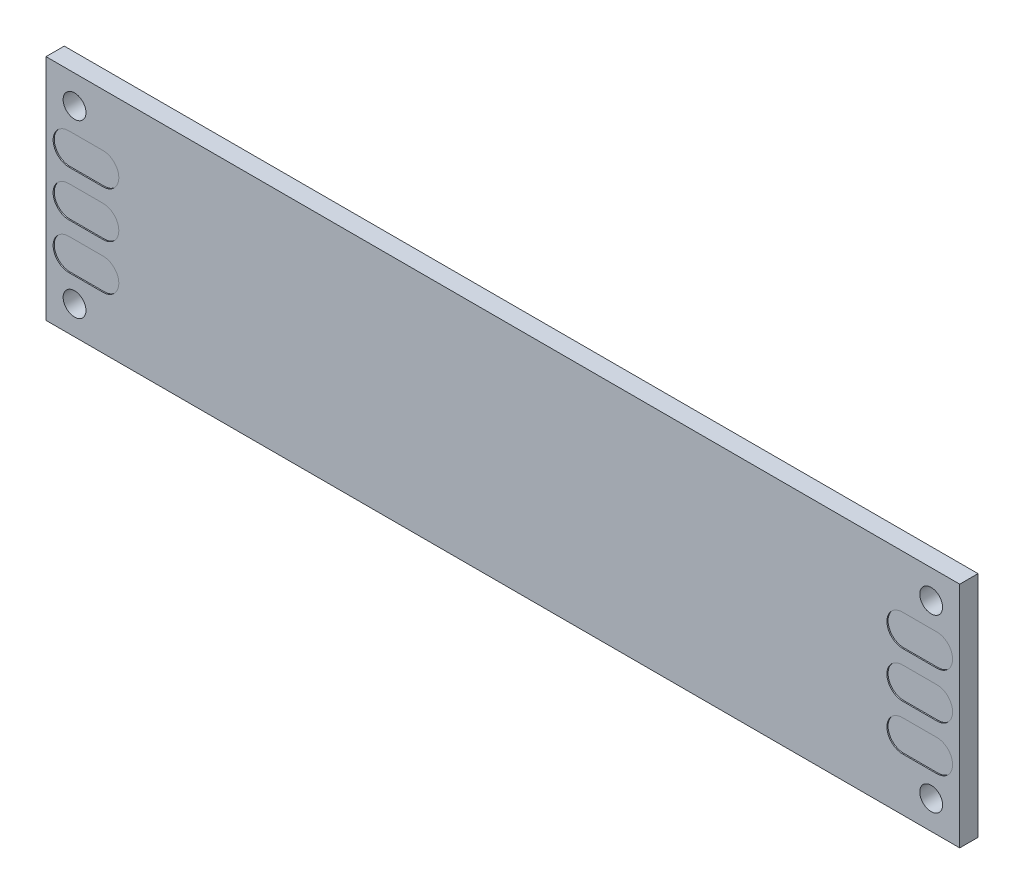
from build123d import *

# Parameters (mm, degrees)
SKETCH_1_W          = 80
SKETCH_1_H          = 20
SKETCH_1_R          = 1
EXTRUDE_1_DEPTH     = 1.6
CUT_EXTRUDE_1_DEPTH = 0.1
CUT_EXTRUDE_START   = -0.1
CUT_EXTRUDE_2_DEPTH = 0.1


with BuildPart() as part:
    # Эскиз1 → Бобышка-Вытянуть1 (new body)
    with BuildSketch(Plane.XY):
        Rectangle(SKETCH_1_W, SKETCH_1_H)
        with Locations((-37.5, 7.5)):
            Circle(SKETCH_1_R, mode=Mode.SUBTRACT)
        with Locations((-37.5, -7.5)):
            Circle(SKETCH_1_R, mode=Mode.SUBTRACT)
        with Locations((37.5, -7.5)):
            Circle(SKETCH_1_R, mode=Mode.SUBTRACT)
        with Locations((37.5, 7.5)):
            Circle(SKETCH_1_R, mode=Mode.SUBTRACT)
    extrude(amount=EXTRUDE_1_DEPTH)

    # Эскиз2 → Вырез-Вытянуть1 (cut)
    with BuildSketch(Plane.XY.offset(1.6)):
        with BuildLine():
            Line((-38, -2.625), (-35, -2.625))
            ThreePointArc((-35, -2.625), (-33.625, -4), (-35, -5.375))
            Line((-35, -5.375), (-38, -5.375))
            ThreePointArc((-38, -5.375), (-39.375, -4), (-38, -2.625))
        make_face()
        with BuildLine():
            Line((-38, 1.375), (-35, 1.375))
            ThreePointArc((-35, 1.375), (-33.625, 0), (-35, -1.375))
            Line((-35, -1.375), (-38, -1.375))
            ThreePointArc((-38, -1.375), (-39.375, 0), (-38, 1.375))
        make_face()
        with BuildLine():
            Line((-38, 5.375), (-35, 5.375))
            ThreePointArc((-35, 5.375), (-33.625, 4), (-35, 2.625))
            Line((-35, 2.625), (-38, 2.625))
            ThreePointArc((-38, 2.625), (-39.375, 4), (-38, 5.375))
        make_face()
        with BuildLine():
            Line((38, -2.625), (35, -2.625))
            ThreePointArc((35, -2.625), (33.625, -4), (35, -5.375))
            Line((35, -5.375), (38, -5.375))
            ThreePointArc((38, -5.375), (39.375, -4), (38, -2.625))
        make_face()
        with BuildLine():
            Line((38, 1.375), (35, 1.375))
            ThreePointArc((35, 1.375), (33.625, 0), (35, -1.375))
            Line((35, -1.375), (38, -1.375))
            ThreePointArc((38, -1.375), (39.375, 0), (38, 1.375))
        make_face()
        with BuildLine():
            Line((38, 5.375), (35, 5.375))
            ThreePointArc((35, 5.375), (33.625, 4), (35, 2.625))
            Line((35, 2.625), (38, 2.625))
            ThreePointArc((38, 2.625), (39.375, 4), (38, 5.375))
        make_face()
    extrude(amount=-CUT_EXTRUDE_1_DEPTH, mode=Mode.SUBTRACT)

    # Эскиз3 → Вырез-Вытянуть2 (cut)
    with BuildSketch(Plane(origin=(0, 0, 0), x_dir=(-1, 0, 0), z_dir=(0, 0, -1)).offset(CUT_EXTRUDE_START)):
        with BuildLine():
            Line((38, 1.375), (35, 1.375))
            ThreePointArc((35, 1.375), (33.625, 0), (35, -1.375))
            Line((35, -1.375), (38, -1.375))
            ThreePointArc((38, -1.375), (39.375, 0), (38, 1.375))
        make_face()
        with BuildLine():
            Line((38, -2.625), (35, -2.625))
            ThreePointArc((35, -2.625), (33.625, -4), (35, -5.375))
            Line((35, -5.375), (38, -5.375))
            ThreePointArc((38, -5.375), (39.375, -4), (38, -2.625))
        make_face()
        with BuildLine():
            Line((38, 5.375), (35, 5.375))
            ThreePointArc((35, 5.375), (33.625, 4), (35, 2.625))
            Line((35, 2.625), (38, 2.625))
            ThreePointArc((38, 2.625), (39.375, 4), (38, 5.375))
        make_face()
        with BuildLine():
            Line((-35, 1.375), (-38, 1.375))
            ThreePointArc((-38, 1.375), (-39.375, 0), (-38, -1.375))
            Line((-38, -1.375), (-35, -1.375))
            ThreePointArc((-35, -1.375), (-33.625, 0), (-35, 1.375))
        make_face()
        with BuildLine():
            Line((-35, -2.625), (-38, -2.625))
            ThreePointArc((-38, -2.625), (-39.375, -4), (-38, -5.375))
            Line((-38, -5.375), (-35, -5.375))
            ThreePointArc((-35, -5.375), (-33.625, -4), (-35, -2.625))
        make_face()
        with BuildLine():
            Line((-35, 5.375), (-38, 5.375))
            ThreePointArc((-38, 5.375), (-39.375, 4), (-38, 2.625))
            Line((-38, 2.625), (-35, 2.625))
            ThreePointArc((-35, 2.625), (-33.625, 4), (-35, 5.375))
        make_face()
    extrude(amount=CUT_EXTRUDE_2_DEPTH, mode=Mode.SUBTRACT)


solid = part.part
